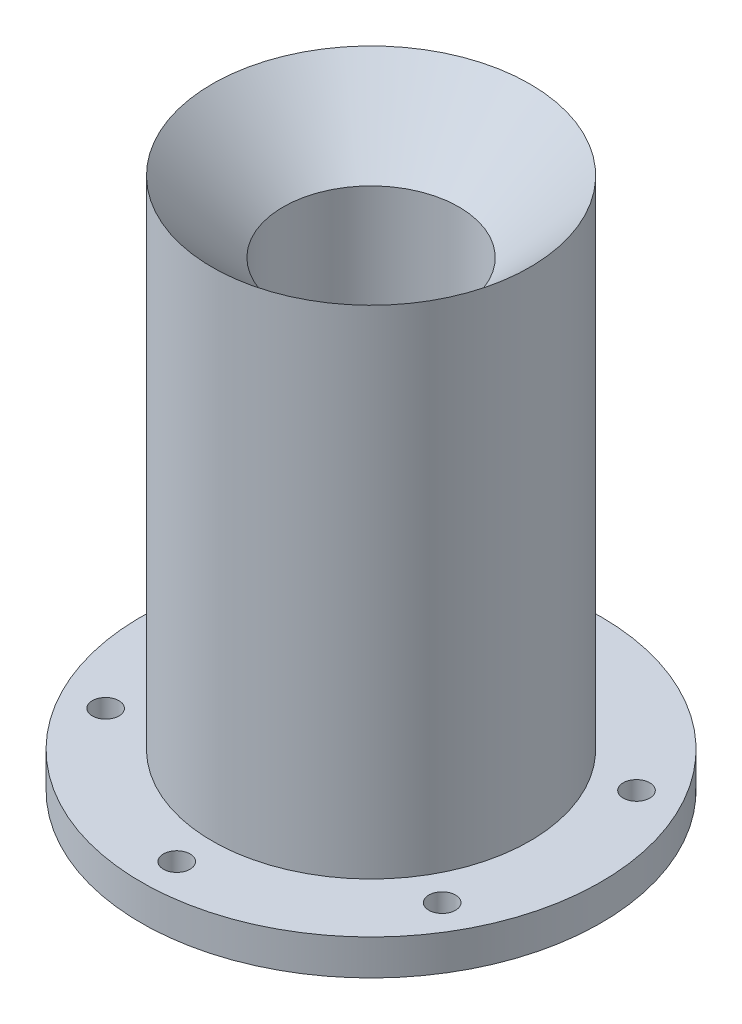
from build123d import *

# Parameters (mm, degrees)
SKETCH_2_R          = 1.5
CUT_EXTRUDE_1_DEPTH = 10


with BuildPart() as part:
    # Эскиз1 → Повернуть1 (revolve)
    with BuildSketch(Plane(origin=(0, 0, 0), x_dir=(0, 0, -1), z_dir=(1, 0, 0))):
        Polygon((9.9, 52), (9.9, 2), (15, 2), (15, 0), (25.9, 0), (25.9, 4), (17.9, 4), (17.9, 60), align=None)
    revolve(axis=Axis((0, 0, 0), (0, 1, 0)))

    # Эскиз2 → Вырез-Вытянуть1 (cut)
    with BuildSketch(Plane(origin=(0, 4, 0), x_dir=(1, 0, 0), z_dir=(0, 1, 0))):
        with Locations(Location((0, 21.9, 0), (0, 0, 270))):
            Circle(SKETCH_2_R)
        with Locations(Location((18.965956343, 10.95, 0), (0, 0, 270))):
            Circle(SKETCH_2_R)
        with Locations(Location((18.965956343, -10.95, 0), (0, 0, 270))):
            Circle(SKETCH_2_R)
        with Locations(Location((0, -21.9, 0), (0, 0, 270))):
            Circle(SKETCH_2_R)
        with Locations(Location((-18.965956343, -10.95, 0), (0, 0, 270))):
            Circle(SKETCH_2_R)
        with Locations(Location((-18.965956343, 10.95, 0), (0, 0, 270))):
            Circle(SKETCH_2_R)
    extrude(amount=-CUT_EXTRUDE_1_DEPTH, mode=Mode.SUBTRACT)


solid = part.part
